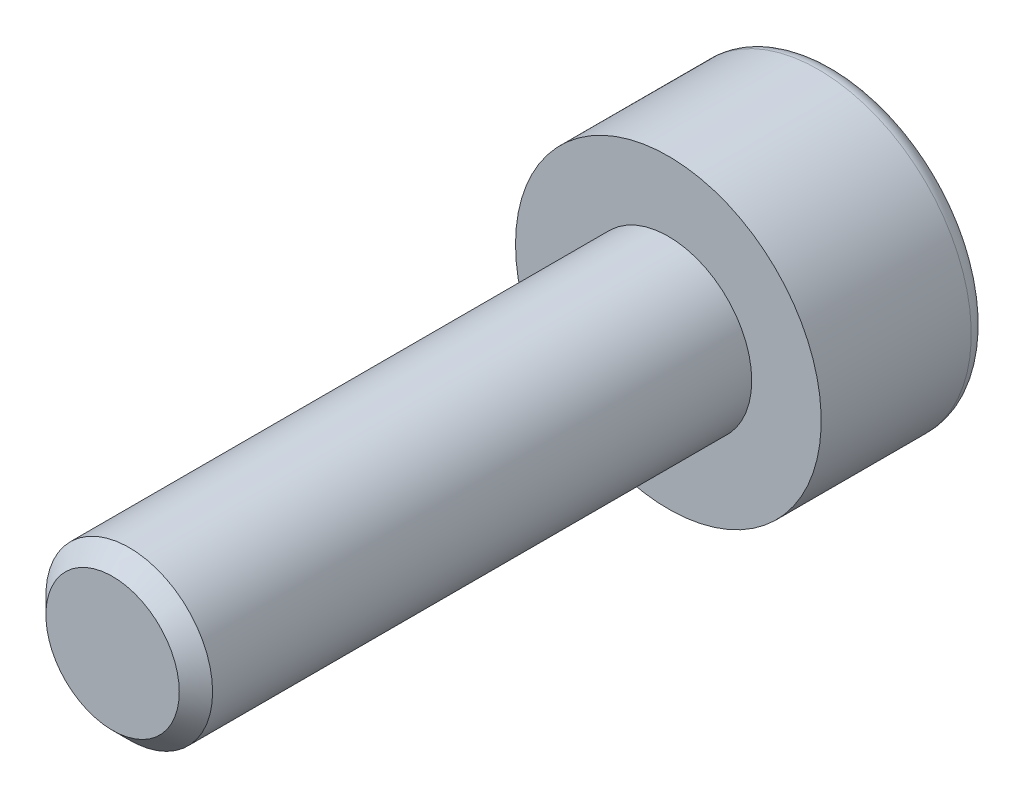
from build123d import *

# Parameters (mm, degrees)
ENLEV_MAT_EXTRU1_DEPTH = 1.3
ESQUISSE3_W            = 1.5
ESQUISSE3_H            = 10
CHANFREIN1_SIZE        = 0.3


with BuildPart() as part:
    # Esquisse1 → Base-Révolution (revolve)
    with BuildSketch(Plane(origin=(0, 0, 0), x_dir=(1, 0, 0), z_dir=(0, 1, 0))):
        with BuildLine():
            Line((0, 0), (2.75, 0))
            Line((2.75, 0), (2.75, 2.7))
            ThreePointArc((2.75, 2.7), (2.662132034, 2.912132034), (2.45, 3))
            Line((2.45, 3), (0, 3))
            Line((0, 3), (0, 0))
        make_face()
    revolve(axis=Axis((0, 0, 0), (0, 0, -1)))

    # Esquisse2 → enlev-mat-Extru1 (cut)
    with BuildSketch(Plane.XY.offset(-3)):
        Polygon((1.25, -0.721687836), (1.25, 0.721687836), (0, 1.443375673), (-1.25, 0.721687836), (-1.25, -0.721687836), (0, -1.443375673), align=None)
    extrude(amount=ENLEV_MAT_EXTRU1_DEPTH, mode=Mode.SUBTRACT)

    # Esquisse3 → Boss.-Révol.1 (revolve)
    with BuildSketch(Plane(origin=(0, 0, 0), x_dir=(1, 0, 0), z_dir=(0, 1, 0))):
        with Locations((0.75, -5)):
            Rectangle(ESQUISSE3_W, ESQUISSE3_H)
    revolve(axis=Axis((0, 0, 0), (0, 0, 1)))

    # Chanfrein1
    chanfrein1_edges = [part.edges().sort_by_distance(p)[0] for p in [
        (-1.5, 0, 10),
    ]]
    chamfer(chanfrein1_edges, length=CHANFREIN1_SIZE)


solid = part.part
